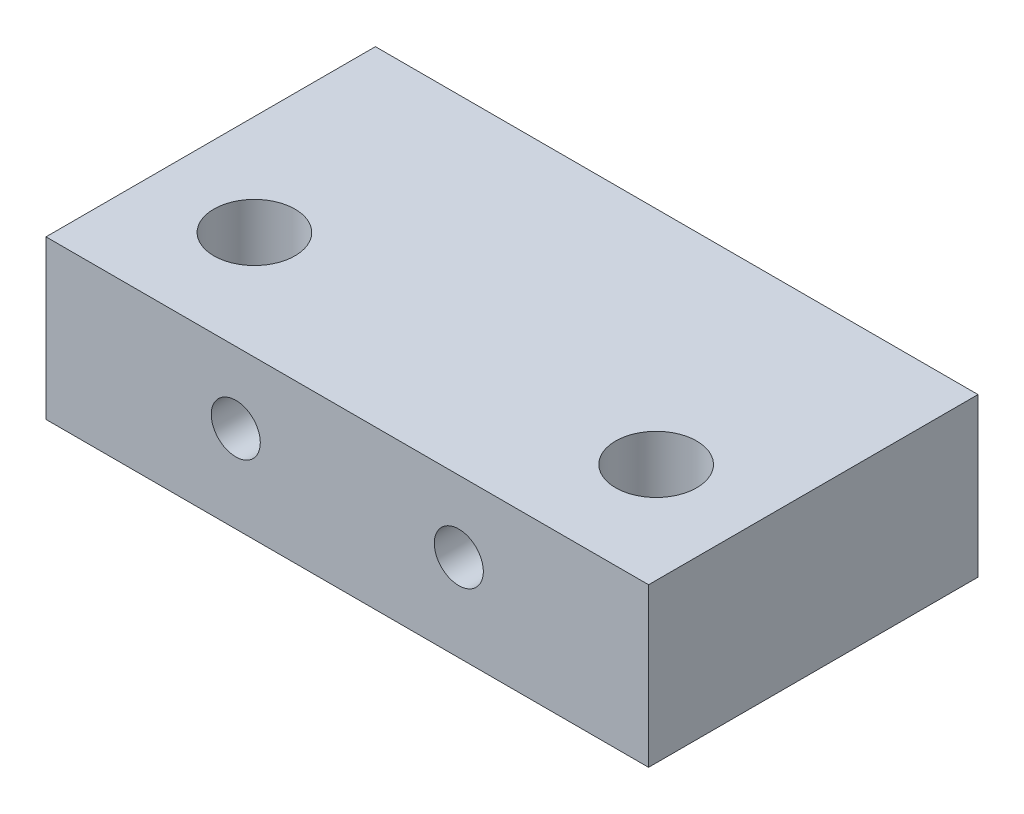
from build123d import *

# Parameters (mm, degrees)
SKETCH1_W           = 38.1
SKETCH1_H           = 20.828
SKETCH1_R           = 2.564
BOSS_EXTRUDE1_DEPTH = 10
SKETCH2_R           = 1.55
CUT_EXTRUDE1_DEPTH  = 10


with BuildPart() as part:
    # Sketch1 → Boss-Extrude1 (new body)
    with BuildSketch(Plane(origin=(0, 0, 0), x_dir=(1, 0, 0), z_dir=(0, 1, 0))):
        with Locations((-19.05, 10.414)):
            Rectangle(SKETCH1_W, SKETCH1_H)
        with Locations(Location((-31.75, 6.828, 0), (0, 0, 270))):
            Circle(SKETCH1_R, mode=Mode.SUBTRACT)
        with Locations(Location((-6.35, 6.828, 0), (0, 0, 90))):
            Circle(SKETCH1_R, mode=Mode.SUBTRACT)
    extrude(amount=BOSS_EXTRUDE1_DEPTH)

    # Sketch2 → Cut-Extrude1 (cut)
    with BuildSketch(Plane.XY):
        with Locations((-26.1, 5.5)):
            Circle(SKETCH2_R)
        with Locations(Location((-12, 5.5, 0), (0, 0, 180))):
            Circle(SKETCH2_R)
    extrude(amount=-CUT_EXTRUDE1_DEPTH, mode=Mode.SUBTRACT)


solid = part.part
